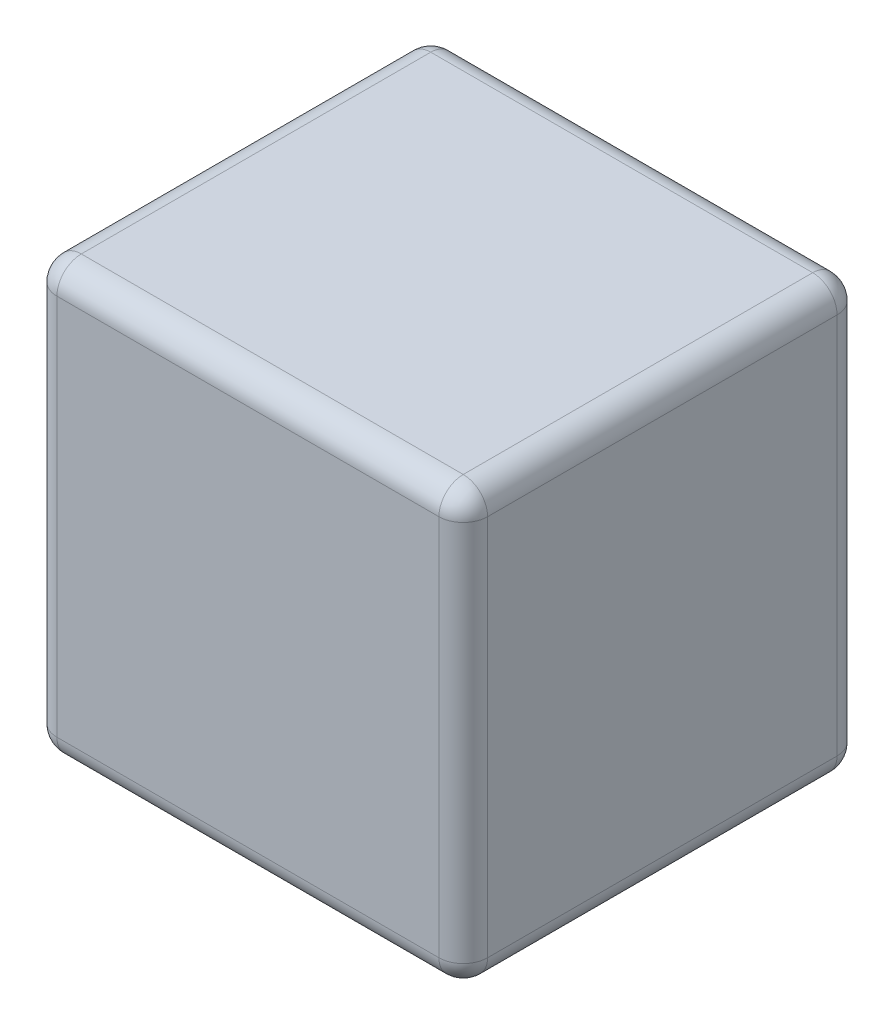
from build123d import *

# Parameters (mm, degrees)
CROQUIS1_W              = 26.5
CROQUIS1_H              = 26.5
SALIENTE_EXTRUIR1_DEPTH = 24.5
REDONDEO1_R             = 1.5


with BuildPart() as part:
    # Croquis1 → Saliente-Extruir1 (new body)
    with BuildSketch(Plane.XY):
        Rectangle(CROQUIS1_W, CROQUIS1_H)
    extrude(amount=SALIENTE_EXTRUIR1_DEPTH)

    # Redondeo1
    redondeo1_edges = [part.edges().sort_by_distance(p)[0] for p in [
        (13.25, 0, 24.5),
        (0, 13.25, 24.5),
        (-13.25, 0, 24.5),
        (0, 13.25, 0),
        (13.25, 0, 0),
        (0, -13.25, 0),
        (-13.25, 0, 0),
        (-13.25, 13.25, 12.25),
        (13.25, 13.25, 12.25),
        (13.25, -13.25, 12.25),
        (-13.25, -13.25, 12.25),
        (0, -13.25, 24.5),
    ]]
    fillet(redondeo1_edges, radius=REDONDEO1_R)


solid = part.part
